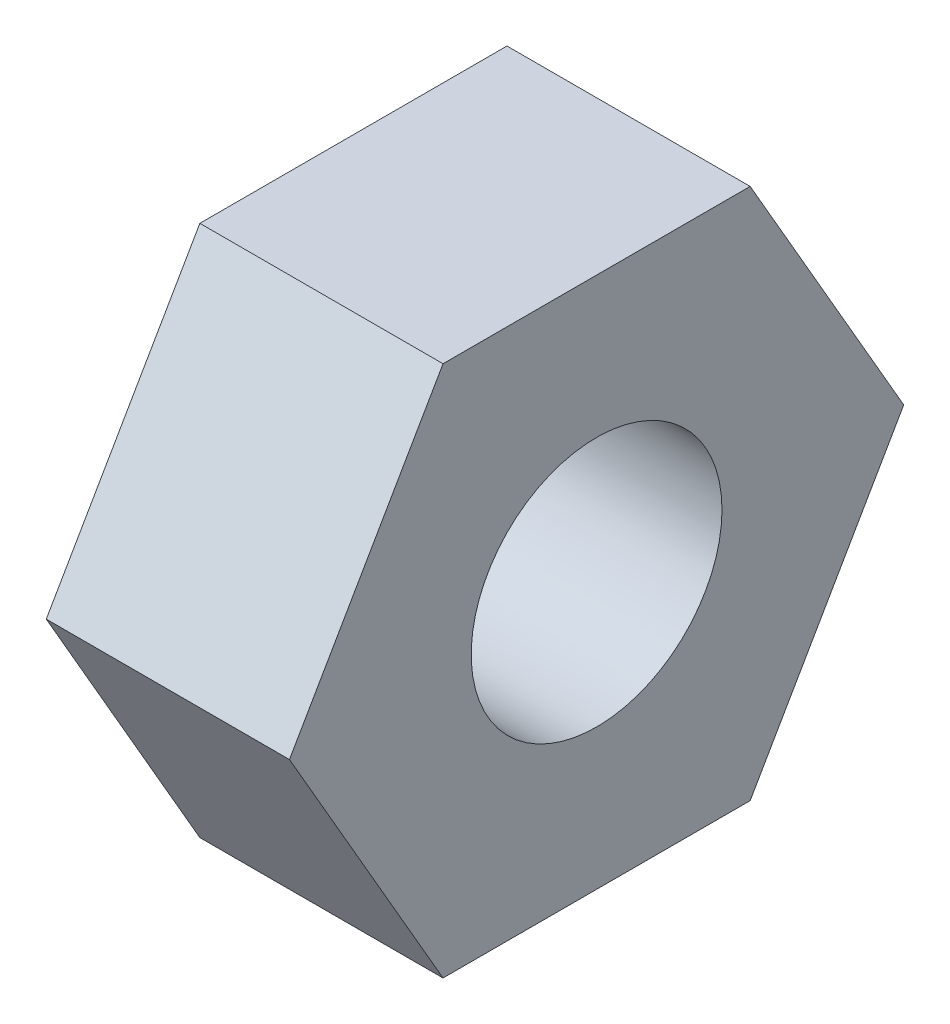
from build123d import *

# Parameters (mm, degrees)
NUT_DEPTH       = 3.2
THREAD_SKETCH_W = 5.2
THREAD_SKETCH_H = 1.65


with BuildPart() as part:
    # Nut Sketch → Nut (new body)
    with BuildSketch(Plane(origin=(0, 0, 0), x_dir=(0, 0, -1), z_dir=(1, 0, 0))):
        Polygon((4.041451884, 0), (2.020725942, 3.5), (-2.020725942, 3.5), (-4.041451884, 0), (-2.020725942, -3.5), (2.020725942, -3.5), align=None)
    extrude(amount=NUT_DEPTH)

    # Thread Sketch → Thread (revolve, cut)
    with BuildSketch(Plane.XY):
        with Locations((1.6, 0.825)):
            Rectangle(THREAD_SKETCH_W, THREAD_SKETCH_H)
    revolve(axis=Axis((-1000, 0, 0), (1, 0, 0)), mode=Mode.SUBTRACT)


solid = part.part
